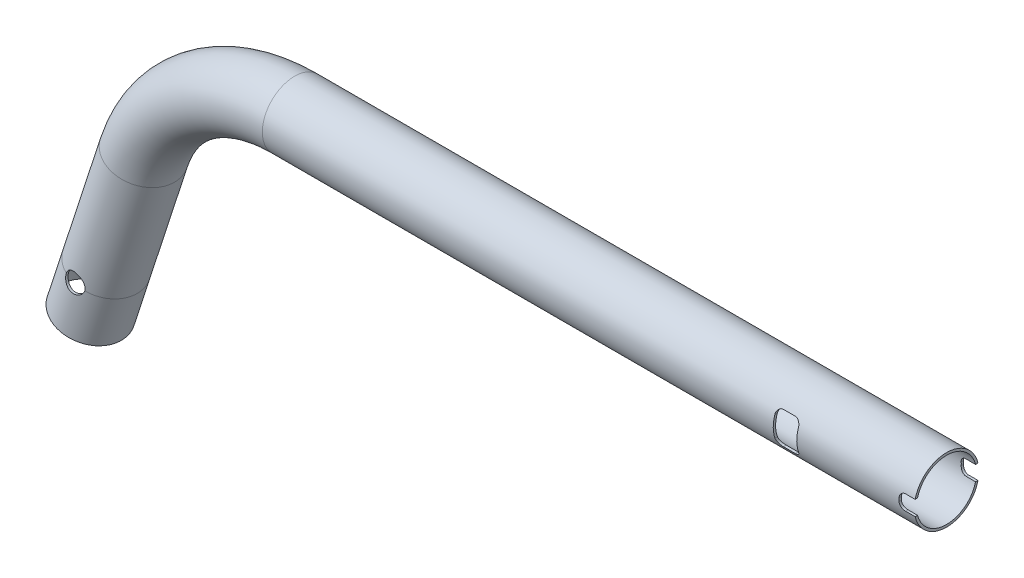
from build123d import *

# Parameters (mm, degrees)
SKETCH3_R               = 11
SKETCH3_R_2             = 10.2
CUT_EXTRUDE1_REACH      = 196.756
SKETCH4_R               = 3.3
SKETCH5_R               = 3.3
CUT_EXTRUDE2_DEPTH      = 195.756456884
CUT_EXTRUDE3_DEPTH      = 195.756456884
CUT_EXTRUDE3_DEPTH_BACK = 195.756456884


with BuildPart() as part:
    # Sweep2: sweep along a path in Sketch1
    with BuildLine(Plane.XY) as sweep2_path:
        Line((132.955173363, 0), (88.955173363, 0))
        Line((88.955173363, 0), (-88.955173363, 0))
        ThreePointArc((-88.955173363, 0), (-120.695576987, -10.313082304), (-140.312225243, -37.313082304))
        Line((-140.312225243, -37.313082304), (-153.044826637, -76.5))
        Line((-153.044826637, -76.5), (-158.406001625, -93))
    # Sketch3 → Sweep2 (sweep)
    with BuildSketch(Plane(origin=(88.955173363, 0, 0), x_dir=(0, 0, -1), z_dir=(1, 0, 0))):
        Circle(SKETCH3_R)
        Circle(SKETCH3_R_2, mode=Mode.SUBTRACT)
    sweep(path=sweep2_path.line)

    # Sketch4 → Cut-Extrude1 (cut, up to next)
    with BuildSketch(Plane.XY, mode=Mode.PRIVATE) as cut_extrude1_sk1:
        with Locations((-153.044826637, -76.5)):
            Circle(SKETCH4_R)
    cut_extrude1_tool1 = extrude(cut_extrude1_sk1.sketch, amount=CUT_EXTRUDE1_REACH, mode=Mode.PRIVATE) & part.part
    # Sketch4 → Cut-Extrude1 (cut, up to next)
    with BuildSketch(Plane.XY, mode=Mode.PRIVATE) as cut_extrude1_sk2:
        with BuildLine():
            Line((133.739588828, 2.555545653), (133.739588828, -2.555545653))
            Line((133.739588828, -2.555545653), (130.539588828, -2.555545653))
            ThreePointArc((130.539588828, -2.555545653), (129.125375266, -1.969759216), (128.539588828, -0.555545653))
            Line((128.539588828, -0.555545653), (128.539588828, 0.555545653))
            ThreePointArc((128.539588828, 0.555545653), (129.125375266, 1.969759216), (130.539588828, 2.555545653))
            Line((130.539588828, 2.555545653), (133.739588828, 2.555545653))
        make_face()
    cut_extrude1_tool2 = extrude(cut_extrude1_sk2.sketch, amount=CUT_EXTRUDE1_REACH, mode=Mode.PRIVATE) & part.part
    # Sketch4 → Cut-Extrude1 (cut, up to next)
    with BuildSketch(Plane.XY, mode=Mode.PRIVATE) as cut_extrude1_sk3:
        with BuildLine():
            Line((86.955173363, -5.5), (90.955173363, -5.5))
            ThreePointArc((90.955173363, -5.5), (92.369386925, -4.914213562), (92.955173363, -3.5))
            Line((92.955173363, -3.5), (92.955173363, 3.5))
            ThreePointArc((92.955173363, 3.5), (92.369386925, 4.914213562), (90.955173363, 5.5))
            Line((90.955173363, 5.5), (86.955173363, 5.5))
            ThreePointArc((86.955173363, 5.5), (85.540959801, 4.914213562), (84.955173363, 3.5))
            Line((84.955173363, 3.5), (84.955173363, -3.5))
            ThreePointArc((84.955173363, -3.5), (85.540959801, -4.914213562), (86.955173363, -5.5))
        make_face()
    cut_extrude1_tool3 = extrude(cut_extrude1_sk3.sketch, amount=CUT_EXTRUDE1_REACH, mode=Mode.PRIVATE) & part.part
    add(cut_extrude1_tool1.solids().sort_by_distance((-153.044827, -76.5, 0))[0], mode=Mode.SUBTRACT)
    add(cut_extrude1_tool2.solids().sort_by_distance((131.288287, 0, 0))[0], mode=Mode.SUBTRACT)
    add(cut_extrude1_tool3.solids().sort_by_distance((88.955173, 0, 0))[0], mode=Mode.SUBTRACT)

    # Sketch5 → Cut-Extrude2 (cut, through all)
    with BuildSketch(Plane.XY):
        with Locations((-153.044826637, -76.5)):
            Circle(SKETCH5_R)
    extrude(amount=-CUT_EXTRUDE2_DEPTH, mode=Mode.SUBTRACT)

    # Sketch6 → Cut-Extrude3 (cut, two sides: drawn at the far end of the back side and taken through both)
    with BuildSketch(Plane.XY.offset(-CUT_EXTRUDE3_DEPTH_BACK)):
        with BuildLine():
            Line((132.955173363, 2.555545653), (129.755173363, 2.555545653))
            ThreePointArc((129.755173363, 2.555545653), (128.340959801, 1.969759216), (127.755173363, 0.555545653))
            Line((127.755173363, 0.555545653), (127.755173363, -0.555545653))
            ThreePointArc((127.755173363, -0.555545653), (128.340959801, -1.969759216), (129.755173363, -2.555545653))
            Line((129.755173363, -2.555545653), (132.955173363, -2.555545653))
            Line((132.955173363, -2.555545653), (132.955173363, 2.555545653))
        make_face()
    extrude(amount=CUT_EXTRUDE3_DEPTH + CUT_EXTRUDE3_DEPTH_BACK, mode=Mode.SUBTRACT)


solid = part.part
